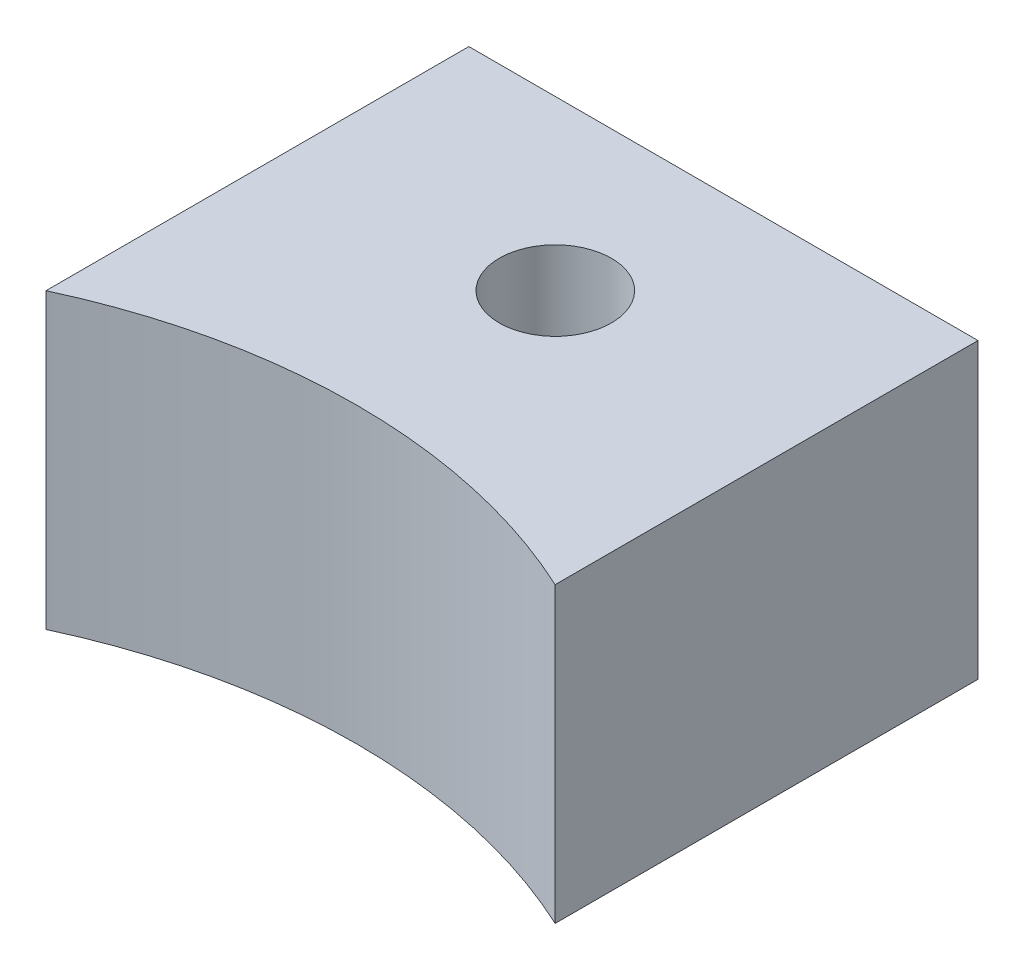
from build123d import *

# Parameters (mm, degrees)
ESQUISSE1_R        = 3.25
BOSS_EXTRU_1_DEPTH = 17


with BuildPart() as part:
    # Esquisse1 → Boss.-Extru.1 (new body)
    with BuildSketch(Plane(origin=(0, 0, 0), x_dir=(1, 0, 0), z_dir=(0, 1, 0))):
        with BuildLine():
            Line((-14.75, 0), (14.75, 0))
            Line((14.75, 0), (14.75, -24.5))
            ThreePointArc((14.75, -24.5), (0, -21.240155954), (-14.75, -24.5))
            Line((-14.75, -24.5), (-14.75, 0))
        make_face()
        with Locations(Location((0, -9.740155954, 0), (0, 0, 270))):
            Circle(ESQUISSE1_R, mode=Mode.SUBTRACT)
    extrude(amount=BOSS_EXTRU_1_DEPTH)


solid = part.part
